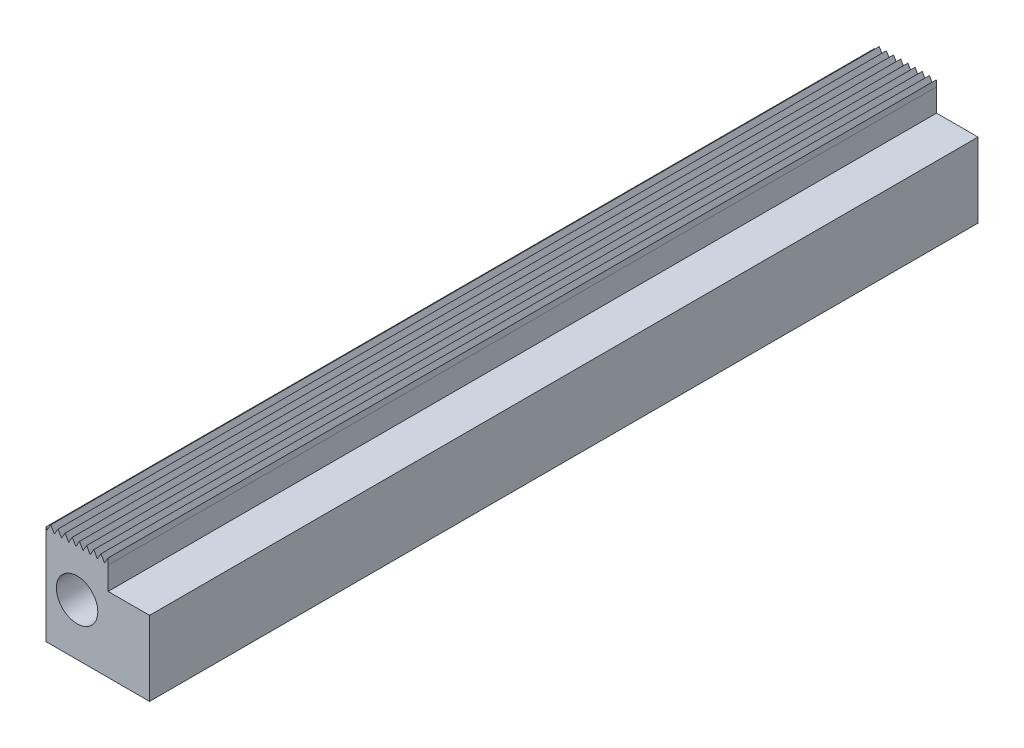
from build123d import *

# Parameters (mm, degrees)
SKETCH1_R           = 5
BOSS_EXTRUDE1_DEPTH = 200


with BuildPart() as part:
    # Sketch1 → Boss-Extrude1 (new body)
    with BuildSketch(Plane.XY):
        Polygon((-12.5, 11.510954988), (-12.5, -12.5), (12.5, -12.5), (12.5, 5.5), (2.5, 5.5), (2.5, 11), (2.498974596, 12.5), (1.633974596, 11.001776051), (0.768974596, 12.5), (-0.096025404, 11.001776051), (-0.961025404, 12.5), (-1.826025404, 11.001776051), (-2.691025404, 12.5), (-3.556025404, 11.001776051), (-4.421025404, 12.5), (-5.286025404, 11.001776051), (-6.151025404, 12.5), (-7.016025404, 11.001776051), (-7.881025404, 12.5), (-8.746025404, 11.001776051), (-9.611025404, 12.5), (-10.476025404, 11.001776051), (-11.341025404, 12.5), (-11.557275404, 12.125444013), (-11.85125, 11.616265076), (-12.206025404, 11.001776051), align=None)
        with Locations((-5, 0)):
            Circle(SKETCH1_R, mode=Mode.SUBTRACT)
    extrude(amount=BOSS_EXTRUDE1_DEPTH)


solid = part.part
